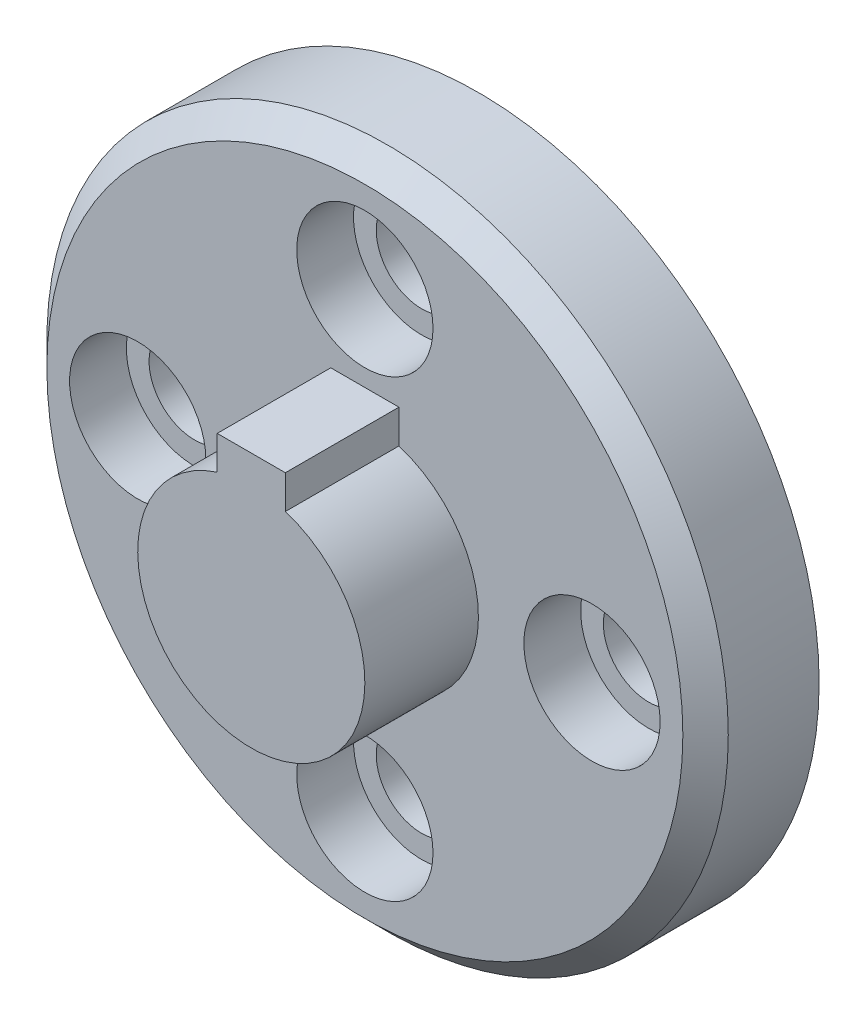
from build123d import *

# Parameters (mm, degrees)
SKETCH1_R           = 15
SKETCH1_R_2         = 2
BOSS_EXTRUDE1_DEPTH = 5
BOSS_EXTRUDE2_DEPTH = 5
SKETCH3_R           = 3
CUT_EXTRUDE1_DEPTH  = 2.5
CHAMFER1_SIZE       = 1


with BuildPart() as part:
    # Sketch1 → Boss-Extrude1 (new body)
    with BuildSketch(Plane.XY):
        Circle(SKETCH1_R)
        with Locations((0, 10)):
            Circle(SKETCH1_R_2, mode=Mode.SUBTRACT)
        with Locations((10, 0)):
            Circle(SKETCH1_R_2, mode=Mode.SUBTRACT)
        with Locations((0, -10)):
            Circle(SKETCH1_R_2, mode=Mode.SUBTRACT)
        with Locations((-10, 0)):
            Circle(SKETCH1_R_2, mode=Mode.SUBTRACT)
    extrude(amount=BOSS_EXTRUDE1_DEPTH)

    # Sketch2 → Boss-Extrude2 (add)
    with BuildSketch(Plane.XY.offset(5)):
        with BuildLine():
            Line((-1.5, 6.25), (1.5, 6.25))
            Line((1.5, 6.25), (1.5, 4.769696007))
            ThreePointArc((1.5, 4.769696007), (0, -5), (-1.5, 4.769696007))
            Line((-1.5, 4.769696007), (-1.5, 6.25))
        make_face()
    extrude(amount=BOSS_EXTRUDE2_DEPTH)

    # Sketch3 → Cut-Extrude1 (cut)
    with BuildSketch(Plane.XY.offset(5)):
        with Locations((0, 10)):
            Circle(SKETCH3_R)
        with Locations((-10, 0)):
            Circle(SKETCH3_R)
        with Locations((10, 0)):
            Circle(SKETCH3_R)
        with Locations((0, -10)):
            Circle(SKETCH3_R)
    extrude(amount=-CUT_EXTRUDE1_DEPTH, mode=Mode.SUBTRACT)

    # Chamfer1
    chamfer1_edges = [part.edges().sort_by_distance(p)[0] for p in [
        (-15, 0, 5),
    ]]
    chamfer(chamfer1_edges, length=CHAMFER1_SIZE)


solid = part.part
